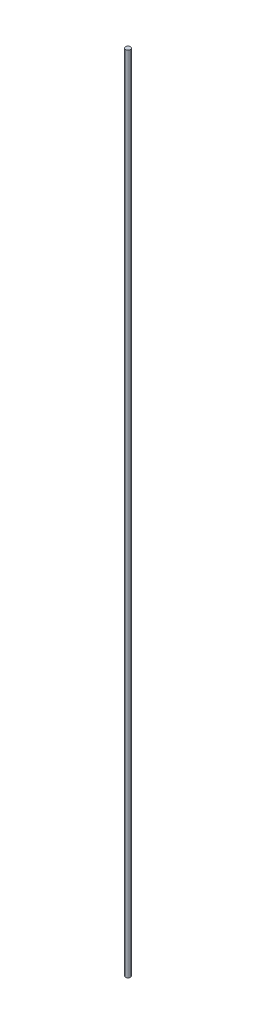
from build123d import *

# Parameters (mm, degrees)
SKETCH_1_R      = 0.5
EXTRUDE_1_DEPTH = 162


with BuildPart() as part:
    # 草图1 → 凸台-拉伸1 (new body)
    with BuildSketch(Plane(origin=(0, 0, 0), x_dir=(1, 0, 0), z_dir=(0, 1, 0))):
        with Locations(Location((0, 0, 0), (0, 0, 270))):
            Circle(SKETCH_1_R)
    extrude(amount=EXTRUDE_1_DEPTH)


solid = part.part
